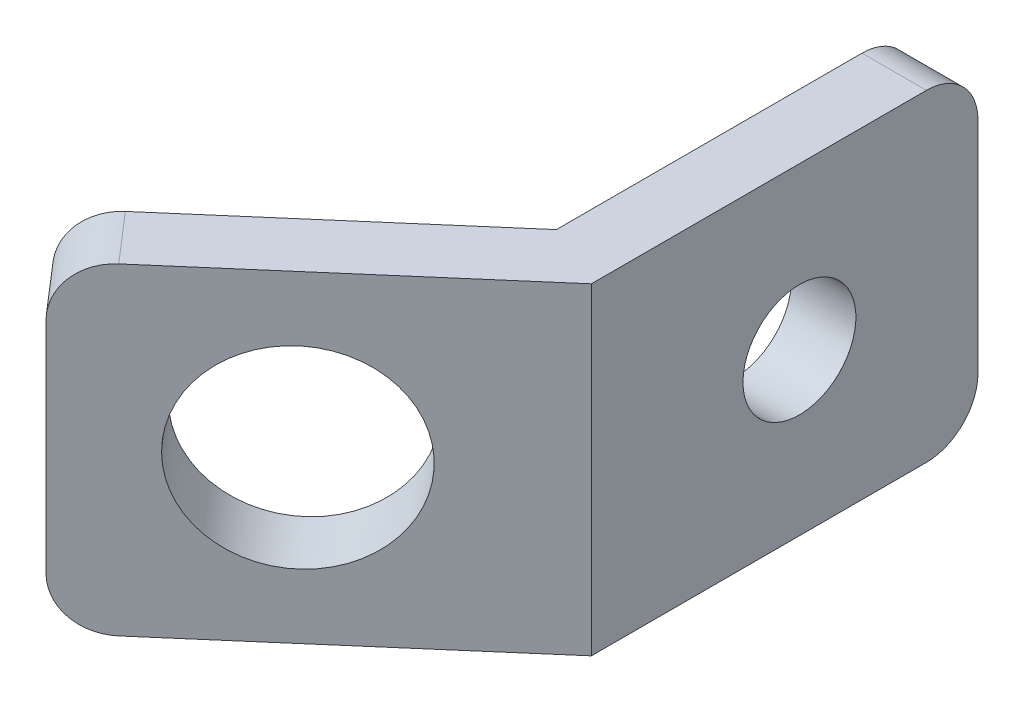
from build123d import *

# Parameters (mm, degrees)
BOSS_EXTRUDE1_DEPTH = 15.875
SKETCH3_R           = 2.7813
CUT_EXTRUDE1_DEPTH  = 29.146650548
SKETCH4_R           = 4.7625
CUT_EXTRUDE2_DEPTH  = 28.146916937
FILLET1_R           = 2.54


with BuildPart() as part:
    # Sketch1 → Boss-Extrude1 (new body)
    with BuildSketch(Plane(origin=(0, 0, 0), x_dir=(1, 0, 0), z_dir=(0, 1, 0))):
        Polygon((0, 0), (0, 19.05), (-3.175, 19.05), (-3.175, 1.452793819), (-16.490998351, -10.051372961), (-14.415343321, -12.453930181), align=None)
    extrude(amount=BOSS_EXTRUDE1_DEPTH)

    # Sketch3 → Cut-Extrude1 (cut, through all)
    with BuildSketch(Plane.ZY.offset(3.175)):
        with Locations((-10.25139691, 7.9375)):
            Circle(SKETCH3_R)
    extrude(amount=-CUT_EXTRUDE1_DEPTH, mode=Mode.SUBTRACT)

    # Sketch4 → Cut-Extrude2 (cut, through all)
    with BuildSketch(Plane(origin=(-2.07565503, 0, -2.40255722), x_dir=(-0.7567109354713432, 0, 0.6537496157842733), z_dir=(-0.6537496157842732, 0, -0.756710935471343))):
        with Locations((10.25139691, 7.9375)):
            Circle(SKETCH4_R)
    extrude(amount=-CUT_EXTRUDE2_DEPTH, mode=Mode.SUBTRACT)

    # Fillet1
    fillet1_edges = [part.edges().sort_by_distance(p)[0] for p in [
        (-1.5875, 15.875, -19.05),
        (-15.453170836, 15.875, 11.252651571),
        (-15.453170836, 0, 11.252651571),
        (-1.5875, 0, -19.05),
    ]]
    fillet(fillet1_edges, radius=FILLET1_R)


solid = part.part
